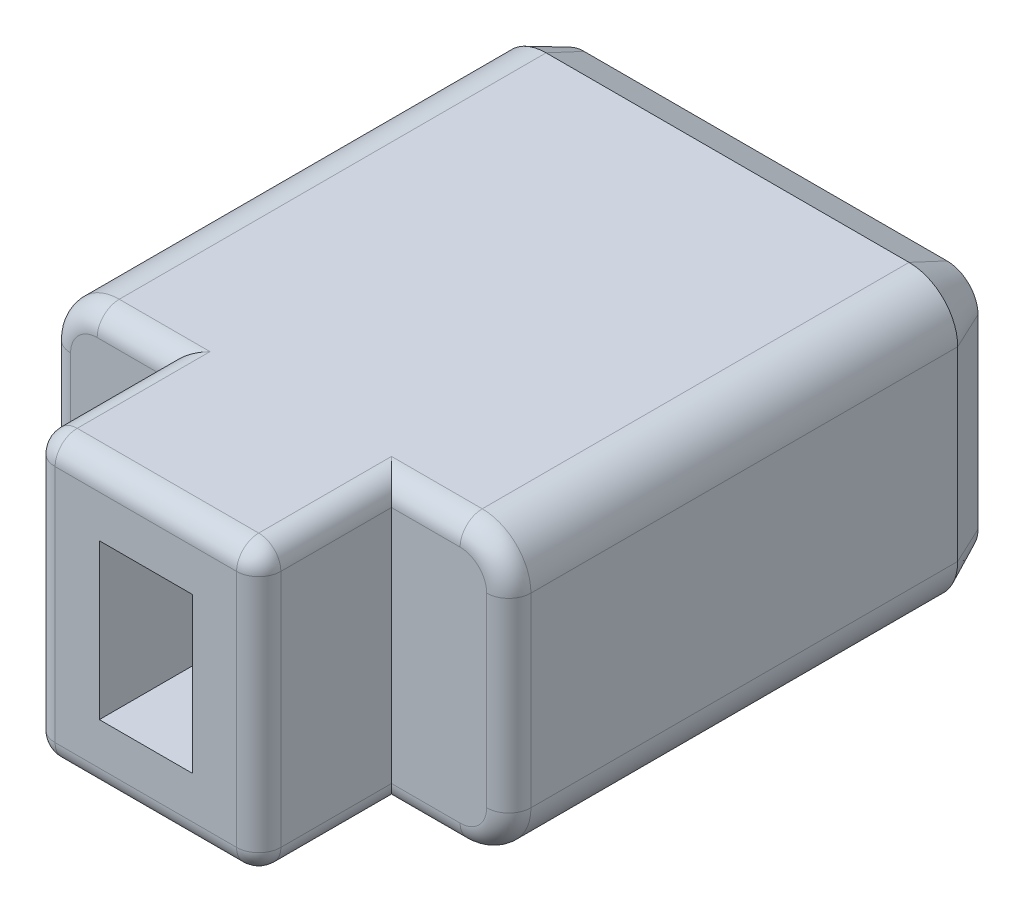
from build123d import *

# Parameters (mm, degrees)
BOSS_EXTRU_1_DEPTH      = 14
ESQUISSE3_W             = 2.1
ESQUISSE3_H             = 3.5
ENL_V_MAT_EXTRU_1_DEPTH = 3
ESQUISSE4_OUTSIDE_W     = 16.116
ESQUISSE4_OUTSIDE_H     = 12.116
ESQUISSE4_OUTSIDE_W_2   = 5.1
ESQUISSE4_OUTSIDE_H_2   = 6.4
ENL_V_MAT_EXTRU_2_DEPTH = 3
CONG_1_R                = 0.5
CHANFREIN1_SIZE         = 0.4
CHANFREIN1_SIZE2        = 0.857802768
ENL_V_MAT_EXTRU_3_DEPTH = 0.3
BOSS_EXTRU_2_DEPTH      = 0.3


with BuildPart() as part:
    # Esquisse2 → Boss.-Extru.1 (new body)
    with BuildSketch(Plane.XY):
        with BuildLine():
            Line((1.1, 0), (9.3, 0))
            ThreePointArc((9.3, 0), (10.077817459, 0.322182541), (10.4, 1.1))
            Line((10.4, 1.1), (10.4, 5.3))
            ThreePointArc((10.4, 5.3), (10.077817459, 6.077817459), (9.3, 6.4))
            Line((9.3, 6.4), (1.1, 6.4))
            ThreePointArc((1.1, 6.4), (0.322182541, 6.077817459), (0, 5.3))
            Line((0, 5.3), (0, 1.1))
            ThreePointArc((0, 1.1), (0.322182541, 0.322182541), (1.1, 0))
        make_face()
    extrude(amount=BOSS_EXTRU_1_DEPTH)

    # Esquisse3 → Enlèv. mat.-Extru.1 (cut)
    with BuildSketch(Plane.XY.offset(14)):
        with Locations((5.2, 3.2)):
            Rectangle(ESQUISSE3_W, ESQUISSE3_H)
    extrude(amount=-ENL_V_MAT_EXTRU_1_DEPTH, mode=Mode.SUBTRACT)

    # Esquisse4 outside → Enlèv. mat.-Extru.2 (cut)
    with BuildSketch(Plane.XY.offset(14)):
        with Locations((5.2, 3.2)):
            Rectangle(ESQUISSE4_OUTSIDE_W, ESQUISSE4_OUTSIDE_H)
        with Locations((5.2, 3.2)):
            Rectangle(ESQUISSE4_OUTSIDE_W_2, ESQUISSE4_OUTSIDE_H_2, mode=Mode.SUBTRACT)
    extrude(amount=-ENL_V_MAT_EXTRU_2_DEPTH, mode=Mode.SUBTRACT)

    # Congé1
    cong_1_edges = [part.edges().sort_by_distance(p)[0] for p in [
        (8.525, 0, 11),
        (10.077817459, 0.322182541, 11),
        (10.4, 3.2, 11),
        (10.077817459, 6.077817459, 11),
        (1.875, 6.4, 11),
        (0.322182541, 6.077817459, 11),
        (1.875, 0, 11),
        (0.322182541, 0.322182541, 11),
        (7.75, 6.4, 12.5),
        (2.65, 6.4, 12.5),
        (7.75, 0, 12.5),
        (2.65, 0, 12.5),
        (2.65, 3.2, 14),
        (5.2, 6.4, 14),
        (7.75, 3.2, 14),
        (5.2, 0, 14),
        (8.525, 6.4, 11),
        (0, 3.2, 11),
    ]]
    fillet(cong_1_edges, radius=CONG_1_R)

    # Chanfrein1
    chanfrein1_edges = [part.edges().sort_by_distance(p)[0] for p in [
        (5.2, 0, 0),
        (10.077817459, 0.322182541, 0),
        (0.322182541, 0.322182541, 0),
        (10.4, 3.2, 0),
        (0, 3.2, 0),
        (10.077817459, 6.077817459, 0),
        (0.322182541, 6.077817459, 0),
        (5.2, 6.4, 0),
    ]]
    chanfrein1_side = [part.faces().sort_by_distance(p)[0] for p in [
        (5.2, 3.2, 0),
    ]]
    chamfer(chanfrein1_edges, length=CHANFREIN1_SIZE, length2=CHANFREIN1_SIZE2, reference=chanfrein1_side[0])

    # Esquisse5 → Enlèv. mat.-Extru.3 (cut)
    with BuildSketch(Plane(origin=(0, 0, 0), x_dir=(-1, 0, 0), z_dir=(0, 0, -1))):
        with BuildLine():
            add(Edge.make_bspline(
                [(-4.020512821, 3.301602564), (-4.020911895, 3.237490288), (-4.021687033, 3.112962487), (-4.029453623, 2.931576965), (-4.039657895, 2.761233687), (-4.057122867, 2.602328729), (-4.077002379, 2.454537409), (-4.103898836, 2.318336336), (-4.133686676, 2.192920764), (-4.169367746, 2.078306948), (-4.208966747, 1.972487166), (-4.251922765, 1.873844337), (-4.299609469, 1.781939083), (-4.350581864, 1.696493671), (-4.40515217, 1.617040024), (-4.464689277, 1.545195476), (-4.527264604, 1.478966922), (-4.593628357, 1.419548449), (-4.663626219, 1.367872957), (-4.73456264, 1.321609448), (-4.808375288, 1.283870803), (-4.883914016, 1.252464116), (-4.961582673, 1.227486437), (-5.041500205, 1.209823218), (-5.123314642, 1.199090447), (-5.178600222, 1.197989634), (-5.206410256, 1.197435897)],
                knots=[0, 0, 0, 0, 1.712877019, 3.326988582, 4.850328076, 6.271266393, 7.597414044, 8.833253358, 9.979089379, 11.039995979, 12.038127203, 12.996775837, 13.912827748, 14.802594919, 15.653836721, 16.485345673, 17.29299284, 18.086549745, 18.861567364, 19.615803961, 20.346722131, 21.07299196, 21.799717448, 22.523458425, 23.25726252, 24, 24, 24, 24], degree=3))
            add(Edge.make_bspline(
                [(-5.206410256, 1.197435897), (-5.234773835, 1.197856676), (-5.290931895, 1.19868979), (-5.373768848, 1.211289031), (-5.455148845, 1.226953307), (-5.533810837, 1.252867378), (-5.61135316, 1.283376293), (-5.685468102, 1.32376974), (-5.75931599, 1.368008245), (-5.829261029, 1.421642984), (-5.898136448, 1.480451636), (-5.961439201, 1.54819639), (-6.022536833, 1.621629), (-6.078767075, 1.702788043), (-6.133147302, 1.790327967), (-6.182067331, 1.885541033), (-6.228148466, 1.987395506), (-6.270739365, 2.096320958), (-6.308639603, 2.214278611), (-6.34094501, 2.341477387), (-6.369350367, 2.478020647), (-6.390869392, 2.624206004), (-6.410234178, 2.779852196), (-6.420894706, 2.945461394), (-6.429824742, 3.120416408), (-6.430448929, 3.240157327), (-6.430769231, 3.301602564)],
                knots=[0, 0, 0, 0, 0.75220614, 1.489319695, 2.220852219, 2.949733443, 3.684523869, 4.429947492, 5.187648757, 5.967684849, 6.766858157, 7.589441672, 8.425666629, 9.301140101, 10.208430577, 11.15995201, 12.140621658, 13.175675118, 14.263319269, 15.427708189, 16.65850267, 17.964291952, 19.349626439, 20.821361425, 22.36887671, 24, 24, 24, 24], degree=3))
            add(Edge.make_bspline(
                [(-6.430769231, 3.301602564), (-6.430305798, 3.362772851), (-6.429400854, 3.482219717), (-6.422438193, 3.656491702), (-6.409516659, 3.821099271), (-6.392113842, 3.975880645), (-6.369738278, 4.121323191), (-6.342767352, 4.257209095), (-6.311127821, 4.383693823), (-6.272926435, 4.500301893), (-6.231316538, 4.608939827), (-6.185570494, 4.710359268), (-6.135679901, 4.804839083), (-6.083447544, 4.893272292), (-6.025939867, 4.9738605), (-5.965001727, 5.047871088), (-5.900246961, 5.11521968), (-5.831706612, 5.175510083), (-5.760942229, 5.229184526), (-5.687219152, 5.275093881), (-5.612067139, 5.314500495), (-5.534640973, 5.346843735), (-5.455223062, 5.371759948), (-5.373900341, 5.389028282), (-5.290912286, 5.401226646), (-5.234767255, 5.402115282), (-5.206410256, 5.402564103)],
                knots=[0, 0, 0, 0, 1.625926502, 3.174937312, 4.634762286, 6.013840289, 7.314135796, 8.544953558, 9.695183173, 10.777339882, 11.80441546, 12.786228703, 13.732569224, 14.643300609, 15.513996549, 16.361191109, 17.189646031, 17.994430762, 18.785317065, 19.547646725, 20.300227906, 21.038576587, 21.77507982, 22.508943555, 23.246916685, 24, 24, 24, 24], degree=3))
            add(Edge.make_bspline(
                [(-5.206410256, 5.402564103), (-5.178600626, 5.402008333), (-5.12331585, 5.400903477), (-5.041495467, 5.390200606), (-4.961927768, 5.372498277), (-4.884580833, 5.348113076), (-4.808735986, 5.318115591), (-4.735861577, 5.278841166), (-4.664487612, 5.234097305), (-4.595222355, 5.182839794), (-4.529714735, 5.123954272), (-4.466751428, 5.05907494), (-4.408306603, 4.986310676), (-4.353077748, 4.907111679), (-4.301846212, 4.82107942), (-4.254304118, 4.728554016), (-4.211513446, 4.62894977), (-4.170950898, 4.522524223), (-4.134313743, 4.407207152), (-4.104784709, 4.281097892), (-4.078108159, 4.144586926), (-4.056489297, 3.997009974), (-4.04121196, 3.838384286), (-4.028981243, 3.669013656), (-4.021823954, 3.488897211), (-4.020957867, 3.365177206), (-4.020512821, 3.301602564)],
                knots=[0, 0, 0, 0, 0.743633083, 1.478322008, 2.202935681, 2.92157138, 3.646008898, 4.381114629, 5.13243131, 5.898384423, 6.682810379, 7.486269515, 8.314261655, 9.176475297, 10.067315361, 10.990823262, 11.957174424, 12.9657133, 14.036849175, 15.191010145, 16.42833965, 17.757104916, 19.17902079, 20.690427988, 22.299346516, 24, 24, 24, 24], degree=3))
        make_face()
        with BuildLine():
            add(Edge.make_bspline(
                [(-4.379487179, 3.3), (-4.379779587, 3.35342219), (-4.380346983, 3.457084295), (-4.385135243, 3.607509198), (-4.393150158, 3.748039045), (-4.403751897, 3.87854911), (-4.419474197, 3.998686179), (-4.436327385, 4.109049288), (-4.458195662, 4.208923878), (-4.48220677, 4.299943929), (-4.509664627, 4.383098612), (-4.540180964, 4.460417645), (-4.573871506, 4.532671188), (-4.610400803, 4.600127923), (-4.650953047, 4.661797332), (-4.692973295, 4.719458073), (-4.739951793, 4.770446886), (-4.803765354, 4.831502164), (-4.8877326, 4.89483389), (-4.994460009, 4.950833116), (-5.104920314, 4.985539091), (-5.180267725, 4.990064032), (-5.217628205, 4.992307692)],
                knots=[0, 0, 0, 0, 1.533890677, 2.976409912, 4.32068653, 5.57534731, 6.734899526, 7.799022707, 8.779764529, 9.668979878, 10.500817703, 11.292628284, 12.054302458, 12.788773575, 13.492867708, 14.172349036, 14.834736512, 15.480260857, 16.707312048, 17.839247027, 18.928605951, 20, 20, 20, 20], degree=3))
            add(Edge.make_bspline(
                [(-5.217628205, 4.992307692), (-5.255258229, 4.990389299), (-5.330571538, 4.986549798), (-5.440929763, 4.952267022), (-5.547048839, 4.897685219), (-5.630071512, 4.835174339), (-5.692917561, 4.775508814), (-5.738412243, 4.724653285), (-5.77964842, 4.667650104), (-5.818091825, 4.60559545), (-5.854487742, 4.538574624), (-5.887978618, 4.466161896), (-5.917570334, 4.387773449), (-5.934766088, 4.333472445), (-5.943589744, 4.305608974)],
                knots=[0, 0, 0, 0, 1.259681964, 2.521146828, 3.839396011, 5.247784635, 5.989235103, 6.744415315, 7.532874599, 8.345794243, 9.191666684, 10.089598853, 11.019715999, 12, 12, 12, 12], degree=3))
            add(Edge.make_bspline(
                [(-5.943589744, 4.305608974), (-5.953720959, 4.269886717), (-5.974334837, 4.19720302), (-6.001119453, 4.084815833), (-6.021943913, 3.966950118), (-6.041121335, 3.844185221), (-6.053890378, 3.715740449), (-6.064938775, 3.581950987), (-6.069986658, 3.442665729), (-6.071185495, 3.348079077), (-6.071794872, 3.3)],
                knots=[0, 0, 0, 0, 0.875956533, 1.782299469, 2.724069677, 3.698984639, 4.712850366, 5.768333165, 6.865627682, 8, 8, 8, 8], degree=3))
            add(Edge.make_bspline(
                [(-6.071794872, 3.3), (-6.071584733, 3.251915565), (-6.07117364, 3.157848583), (-6.065125373, 3.020268389), (-6.056917984, 2.889261457), (-6.043393351, 2.765138771), (-6.029287693, 2.6472717), (-6.008647133, 2.536498336), (-5.985686678, 2.432182443), (-5.95923148, 2.334316961), (-5.929979671, 2.242949321), (-5.896586545, 2.158459438), (-5.861857442, 2.079681886), (-5.823226662, 2.007580001), (-5.782462568, 1.941593056), (-5.738905975, 1.881777873), (-5.692898579, 1.828043293), (-5.628385253, 1.767291709), (-5.544808554, 1.704214198), (-5.438953102, 1.64849731), (-5.329182829, 1.614567615), (-5.254711982, 1.609977846), (-5.217628205, 1.607692308)],
                knots=[0, 0, 0, 0, 1.380925582, 2.701487514, 3.954759264, 5.150134482, 6.287201315, 7.363077027, 8.384863176, 9.354399778, 10.273840592, 11.138560363, 11.96264889, 12.745125087, 13.485915552, 14.188670158, 14.868482057, 15.51419708, 16.73087182, 17.863141155, 18.935921919, 20, 20, 20, 20], degree=3))
            add(Edge.make_bspline(
                [(-5.217628205, 1.607692308), (-5.180016158, 1.609983366), (-5.104508137, 1.614582777), (-4.993344019, 1.648315702), (-4.886608666, 1.704014744), (-4.802784125, 1.767221715), (-4.739080074, 1.827657633), (-4.693352401, 1.879199527), (-4.650532879, 1.935582312), (-4.61137998, 1.997766084), (-4.574810877, 2.06470837), (-4.5408126, 2.136564551), (-4.510413915, 2.213687917), (-4.483306315, 2.296997893), (-4.457601906, 2.387603306), (-4.437762769, 2.488237199), (-4.41873708, 2.598723374), (-4.405310355, 2.719729036), (-4.392696573, 2.85028734), (-4.38524976, 2.991168731), (-4.380313644, 3.142110882), (-4.37976822, 3.24630947), (-4.379487179, 3.3)],
                knots=[0, 0, 0, 0, 1.078426572, 2.164993967, 3.303109781, 4.518750912, 5.163917377, 5.820815102, 6.493793122, 7.193352139, 7.927416062, 8.681729197, 9.473100796, 10.304477447, 11.195213749, 12.173822244, 13.246157428, 14.41173915, 15.666383497, 17.009914843, 18.459295279, 20, 20, 20, 20], degree=3))
        make_face(mode=Mode.SUBTRACT)
    extrude(amount=-ENL_V_MAT_EXTRU_3_DEPTH, mode=Mode.SUBTRACT)


with BuildPart() as body_2:
    # Esquisse5<2> → Boss.-Extru.2 (new body)
    with BuildSketch(Plane(origin=(0, 0, 0), x_dir=(-1, 0, 0), z_dir=(0, 0, -1))):
        with BuildLine():
            add(Edge.make_bspline(
                [(-4.020512821, 3.301602564), (-4.020911895, 3.237490288), (-4.021687033, 3.112962487), (-4.029453623, 2.931576965), (-4.039657895, 2.761233687), (-4.057122867, 2.602328729), (-4.077002379, 2.454537409), (-4.103898836, 2.318336336), (-4.133686676, 2.192920764), (-4.169367746, 2.078306948), (-4.208966747, 1.972487166), (-4.251922765, 1.873844337), (-4.299609469, 1.781939083), (-4.350581864, 1.696493671), (-4.40515217, 1.617040024), (-4.464689277, 1.545195476), (-4.527264604, 1.478966922), (-4.593628357, 1.419548449), (-4.663626219, 1.367872957), (-4.73456264, 1.321609448), (-4.808375288, 1.283870803), (-4.883914016, 1.252464116), (-4.961582673, 1.227486437), (-5.041500205, 1.209823218), (-5.123314642, 1.199090447), (-5.178600222, 1.197989634), (-5.206410256, 1.197435897)],
                knots=[0, 0, 0, 0, 1.712877019, 3.326988582, 4.850328076, 6.271266393, 7.597414044, 8.833253358, 9.979089379, 11.039995979, 12.038127203, 12.996775837, 13.912827748, 14.802594919, 15.653836721, 16.485345673, 17.29299284, 18.086549745, 18.861567364, 19.615803961, 20.346722131, 21.07299196, 21.799717448, 22.523458425, 23.25726252, 24, 24, 24, 24], degree=3))
            add(Edge.make_bspline(
                [(-5.206410256, 1.197435897), (-5.234773835, 1.197856676), (-5.290931895, 1.19868979), (-5.373768848, 1.211289031), (-5.455148845, 1.226953307), (-5.533810837, 1.252867378), (-5.61135316, 1.283376293), (-5.685468102, 1.32376974), (-5.75931599, 1.368008245), (-5.829261029, 1.421642984), (-5.898136448, 1.480451636), (-5.961439201, 1.54819639), (-6.022536833, 1.621629), (-6.078767075, 1.702788043), (-6.133147302, 1.790327967), (-6.182067331, 1.885541033), (-6.228148466, 1.987395506), (-6.270739365, 2.096320958), (-6.308639603, 2.214278611), (-6.34094501, 2.341477387), (-6.369350367, 2.478020647), (-6.390869392, 2.624206004), (-6.410234178, 2.779852196), (-6.420894706, 2.945461394), (-6.429824742, 3.120416408), (-6.430448929, 3.240157327), (-6.430769231, 3.301602564)],
                knots=[0, 0, 0, 0, 0.75220614, 1.489319695, 2.220852219, 2.949733443, 3.684523869, 4.429947492, 5.187648757, 5.967684849, 6.766858157, 7.589441672, 8.425666629, 9.301140101, 10.208430577, 11.15995201, 12.140621658, 13.175675118, 14.263319269, 15.427708189, 16.65850267, 17.964291952, 19.349626439, 20.821361425, 22.36887671, 24, 24, 24, 24], degree=3))
            add(Edge.make_bspline(
                [(-6.430769231, 3.301602564), (-6.430305798, 3.362772851), (-6.429400854, 3.482219717), (-6.422438193, 3.656491702), (-6.409516659, 3.821099271), (-6.392113842, 3.975880645), (-6.369738278, 4.121323191), (-6.342767352, 4.257209095), (-6.311127821, 4.383693823), (-6.272926435, 4.500301893), (-6.231316538, 4.608939827), (-6.185570494, 4.710359268), (-6.135679901, 4.804839083), (-6.083447544, 4.893272292), (-6.025939867, 4.9738605), (-5.965001727, 5.047871088), (-5.900246961, 5.11521968), (-5.831706612, 5.175510083), (-5.760942229, 5.229184526), (-5.687219152, 5.275093881), (-5.612067139, 5.314500495), (-5.534640973, 5.346843735), (-5.455223062, 5.371759948), (-5.373900341, 5.389028282), (-5.290912286, 5.401226646), (-5.234767255, 5.402115282), (-5.206410256, 5.402564103)],
                knots=[0, 0, 0, 0, 1.625926502, 3.174937312, 4.634762286, 6.013840289, 7.314135796, 8.544953558, 9.695183173, 10.777339882, 11.80441546, 12.786228703, 13.732569224, 14.643300609, 15.513996549, 16.361191109, 17.189646031, 17.994430762, 18.785317065, 19.547646725, 20.300227906, 21.038576587, 21.77507982, 22.508943555, 23.246916685, 24, 24, 24, 24], degree=3))
            add(Edge.make_bspline(
                [(-5.206410256, 5.402564103), (-5.178600626, 5.402008333), (-5.12331585, 5.400903477), (-5.041495467, 5.390200606), (-4.961927768, 5.372498277), (-4.884580833, 5.348113076), (-4.808735986, 5.318115591), (-4.735861577, 5.278841166), (-4.664487612, 5.234097305), (-4.595222355, 5.182839794), (-4.529714735, 5.123954272), (-4.466751428, 5.05907494), (-4.408306603, 4.986310676), (-4.353077748, 4.907111679), (-4.301846212, 4.82107942), (-4.254304118, 4.728554016), (-4.211513446, 4.62894977), (-4.170950898, 4.522524223), (-4.134313743, 4.407207152), (-4.104784709, 4.281097892), (-4.078108159, 4.144586926), (-4.056489297, 3.997009974), (-4.04121196, 3.838384286), (-4.028981243, 3.669013656), (-4.021823954, 3.488897211), (-4.020957867, 3.365177206), (-4.020512821, 3.301602564)],
                knots=[0, 0, 0, 0, 0.743633083, 1.478322008, 2.202935681, 2.92157138, 3.646008898, 4.381114629, 5.13243131, 5.898384423, 6.682810379, 7.486269515, 8.314261655, 9.176475297, 10.067315361, 10.990823262, 11.957174424, 12.9657133, 14.036849175, 15.191010145, 16.42833965, 17.757104916, 19.17902079, 20.690427988, 22.299346516, 24, 24, 24, 24], degree=3))
        make_face()
        with BuildLine():
            add(Edge.make_bspline(
                [(-4.379487179, 3.3), (-4.379779587, 3.35342219), (-4.380346983, 3.457084295), (-4.385135243, 3.607509198), (-4.393150158, 3.748039045), (-4.403751897, 3.87854911), (-4.419474197, 3.998686179), (-4.436327385, 4.109049288), (-4.458195662, 4.208923878), (-4.48220677, 4.299943929), (-4.509664627, 4.383098612), (-4.540180964, 4.460417645), (-4.573871506, 4.532671188), (-4.610400803, 4.600127923), (-4.650953047, 4.661797332), (-4.692973295, 4.719458073), (-4.739951793, 4.770446886), (-4.803765354, 4.831502164), (-4.8877326, 4.89483389), (-4.994460009, 4.950833116), (-5.104920314, 4.985539091), (-5.180267725, 4.990064032), (-5.217628205, 4.992307692)],
                knots=[0, 0, 0, 0, 1.533890677, 2.976409912, 4.32068653, 5.57534731, 6.734899526, 7.799022707, 8.779764529, 9.668979878, 10.500817703, 11.292628284, 12.054302458, 12.788773575, 13.492867708, 14.172349036, 14.834736512, 15.480260857, 16.707312048, 17.839247027, 18.928605951, 20, 20, 20, 20], degree=3))
            add(Edge.make_bspline(
                [(-5.217628205, 4.992307692), (-5.255258229, 4.990389299), (-5.330571538, 4.986549798), (-5.440929763, 4.952267022), (-5.547048839, 4.897685219), (-5.630071512, 4.835174339), (-5.692917561, 4.775508814), (-5.738412243, 4.724653285), (-5.77964842, 4.667650104), (-5.818091825, 4.60559545), (-5.854487742, 4.538574624), (-5.887978618, 4.466161896), (-5.917570334, 4.387773449), (-5.934766088, 4.333472445), (-5.943589744, 4.305608974)],
                knots=[0, 0, 0, 0, 1.259681964, 2.521146828, 3.839396011, 5.247784635, 5.989235103, 6.744415315, 7.532874599, 8.345794243, 9.191666684, 10.089598853, 11.019715999, 12, 12, 12, 12], degree=3))
            add(Edge.make_bspline(
                [(-5.943589744, 4.305608974), (-5.953720959, 4.269886717), (-5.974334837, 4.19720302), (-6.001119453, 4.084815833), (-6.021943913, 3.966950118), (-6.041121335, 3.844185221), (-6.053890378, 3.715740449), (-6.064938775, 3.581950987), (-6.069986658, 3.442665729), (-6.071185495, 3.348079077), (-6.071794872, 3.3)],
                knots=[0, 0, 0, 0, 0.875956533, 1.782299469, 2.724069677, 3.698984639, 4.712850366, 5.768333165, 6.865627682, 8, 8, 8, 8], degree=3))
            add(Edge.make_bspline(
                [(-6.071794872, 3.3), (-6.071584733, 3.251915565), (-6.07117364, 3.157848583), (-6.065125373, 3.020268389), (-6.056917984, 2.889261457), (-6.043393351, 2.765138771), (-6.029287693, 2.6472717), (-6.008647133, 2.536498336), (-5.985686678, 2.432182443), (-5.95923148, 2.334316961), (-5.929979671, 2.242949321), (-5.896586545, 2.158459438), (-5.861857442, 2.079681886), (-5.823226662, 2.007580001), (-5.782462568, 1.941593056), (-5.738905975, 1.881777873), (-5.692898579, 1.828043293), (-5.628385253, 1.767291709), (-5.544808554, 1.704214198), (-5.438953102, 1.64849731), (-5.329182829, 1.614567615), (-5.254711982, 1.609977846), (-5.217628205, 1.607692308)],
                knots=[0, 0, 0, 0, 1.380925582, 2.701487514, 3.954759264, 5.150134482, 6.287201315, 7.363077027, 8.384863176, 9.354399778, 10.273840592, 11.138560363, 11.96264889, 12.745125087, 13.485915552, 14.188670158, 14.868482057, 15.51419708, 16.73087182, 17.863141155, 18.935921919, 20, 20, 20, 20], degree=3))
            add(Edge.make_bspline(
                [(-5.217628205, 1.607692308), (-5.180016158, 1.609983366), (-5.104508137, 1.614582777), (-4.993344019, 1.648315702), (-4.886608666, 1.704014744), (-4.802784125, 1.767221715), (-4.739080074, 1.827657633), (-4.693352401, 1.879199527), (-4.650532879, 1.935582312), (-4.61137998, 1.997766084), (-4.574810877, 2.06470837), (-4.5408126, 2.136564551), (-4.510413915, 2.213687917), (-4.483306315, 2.296997893), (-4.457601906, 2.387603306), (-4.437762769, 2.488237199), (-4.41873708, 2.598723374), (-4.405310355, 2.719729036), (-4.392696573, 2.85028734), (-4.38524976, 2.991168731), (-4.380313644, 3.142110882), (-4.37976822, 3.24630947), (-4.379487179, 3.3)],
                knots=[0, 0, 0, 0, 1.078426572, 2.164993967, 3.303109781, 4.518750912, 5.163917377, 5.820815102, 6.493793122, 7.193352139, 7.927416062, 8.681729197, 9.473100796, 10.304477447, 11.195213749, 12.173822244, 13.246157428, 14.41173915, 15.666383497, 17.009914843, 18.459295279, 20, 20, 20, 20], degree=3))
        make_face(mode=Mode.SUBTRACT)
    extrude(amount=BOSS_EXTRU_2_DEPTH)


solid = Compound([part.part, body_2.part])
